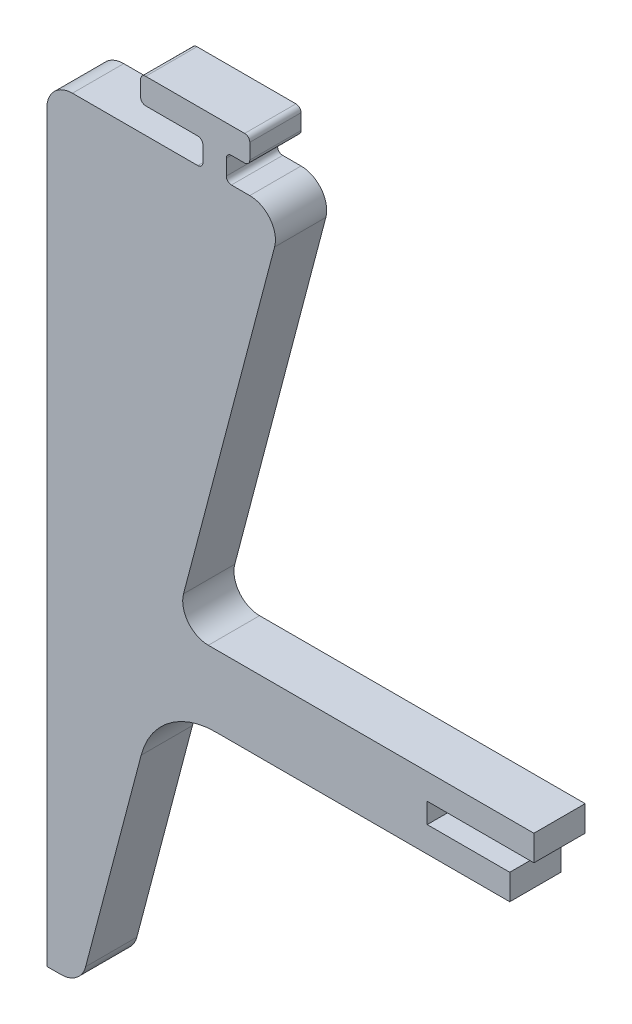
from build123d import *

# Parameters (mm, degrees)
BOSS_EXTRUDE1_DEPTH = 5.08
BOSS_EXTRUDE2_DEPTH = 5.08


with BuildPart() as part:
    # Sketch1 → Boss-Extrude1 (new body)
    with BuildSketch(Plane.XY):
        with BuildLine():
            Line((-9.251487929, 55.88), (0.551476187, 55.88))
            ThreePointArc((0.551476187, 55.88), (0.910686432, 55.731210245), (1.059476187, 55.372))
            Line((1.059476187, 55.372), (1.059476187, 53.848))
            ThreePointArc((1.059476187, 53.848), (0.910686432, 53.488789755), (0.551476187, 53.34))
            Line((0.551476187, 53.34), (-0.762, 53.34))
            ThreePointArc((-0.762, 53.34), (-1.121210245, 53.191210245), (-1.27, 52.832))
            Line((-1.27, 52.832), (-1.27, 51.308))
            ThreePointArc((-1.27, 51.308), (-1.121210245, 50.948789755), (-0.762, 50.8))
            Line((-0.762, 50.8), (1.059476187, 50.8))
            ThreePointArc((1.059476187, 50.8), (3.071209903, 49.810653879), (3.515777519, 47.613328704))
            Line((3.515777519, 47.613328704), (-15.208009334, -23.506671296))
            ThreePointArc((-15.208009334, -23.506671296), (-16.113656787, -24.871733717), (-17.664310667, -25.4))
            Line((-17.664310667, -25.4), (-19.05, -25.4))
            Line((-19.05, -25.4), (-19.05, 48.26))
            ThreePointArc((-19.05, 48.26), (-18.306051224, 50.056051224), (-16.51, 50.8))
            Line((-16.51, 50.8), (-4.092493287, 50.8))
            ThreePointArc((-4.092493287, 50.8), (-3.733283042, 50.948789755), (-3.584493287, 51.308))
            Line((-3.584493287, 51.308), (-3.584493287, 52.832))
            ThreePointArc((-3.584493287, 52.832), (-3.733283042, 53.191210245), (-4.092493287, 53.34))
            Line((-4.092493287, 53.34), (-9.251487929, 53.34))
            ThreePointArc((-9.251487929, 53.34), (-9.610698174, 53.488789755), (-9.759487929, 53.848))
            Line((-9.759487929, 53.848), (-9.759487929, 55.372))
            ThreePointArc((-9.759487929, 55.372), (-9.610698174, 55.731210245), (-9.251487929, 55.88))
        make_face()
    extrude(amount=BOSS_EXTRUDE1_DEPTH)

    # Sketch3 → Boss-Extrude2 (add)
    with BuildSketch(Plane.XY.offset(5.08)):
        with BuildLine():
            Line((29.21, 10.16), (0, 10.16))
            Line((0, 10.16), (-3.049315827, 10.16))
            ThreePointArc((-3.049315827, 10.16), (-5.061049543, 11.149346121), (-5.505617159, 13.346671296))
            Line((-5.505617159, 13.346671296), (-9.703476753, -2.598381736))
            ThreePointArc((-9.703476753, -2.598381736), (-6.986534394, 1.496805525), (-2.334572756, 3.081604376))
            Line((-2.334572756, 3.081604376), (26.819356948, 3.081604376))
            Line((26.819356948, 3.081604376), (26.819356948, 5.616399787))
            Line((26.819356948, 5.616399787), (18.639798787, 5.616399787))
            Line((18.639798787, 5.616399787), (18.639798787, 7.62))
            Line((18.639798787, 7.62), (29.21, 7.62))
            Line((29.21, 7.62), (29.21, 10.16))
        make_face()
    extrude(amount=-BOSS_EXTRUDE2_DEPTH)


solid = part.part
